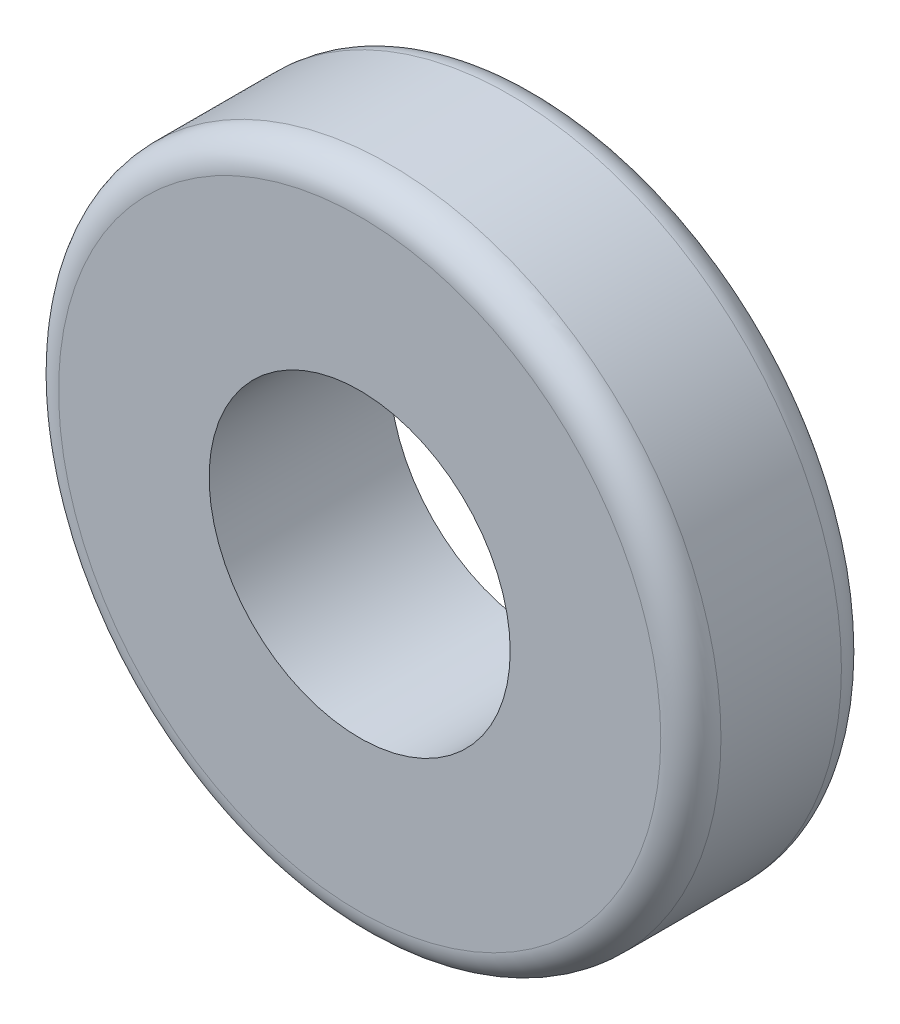
from build123d import *

# Parameters (mm, degrees)
CROQUIS1_R              = 11
CROQUIS1_R_2            = 5
SALIENTE_EXTRUIR1_DEPTH = 6
REDONDEO1_R             = 1


with BuildPart() as part:
    # Croquis1 → Saliente-Extruir1 (new body)
    with BuildSketch(Plane.XY):
        Circle(CROQUIS1_R)
        Circle(CROQUIS1_R_2, mode=Mode.SUBTRACT)
    extrude(amount=SALIENTE_EXTRUIR1_DEPTH)

    # Redondeo1
    redondeo1_edges = [part.edges().sort_by_distance(p)[0] for p in [
        (-11, 0, 0),
        (-11, 0, 6),
    ]]
    fillet(redondeo1_edges, radius=REDONDEO1_R)


solid = part.part
